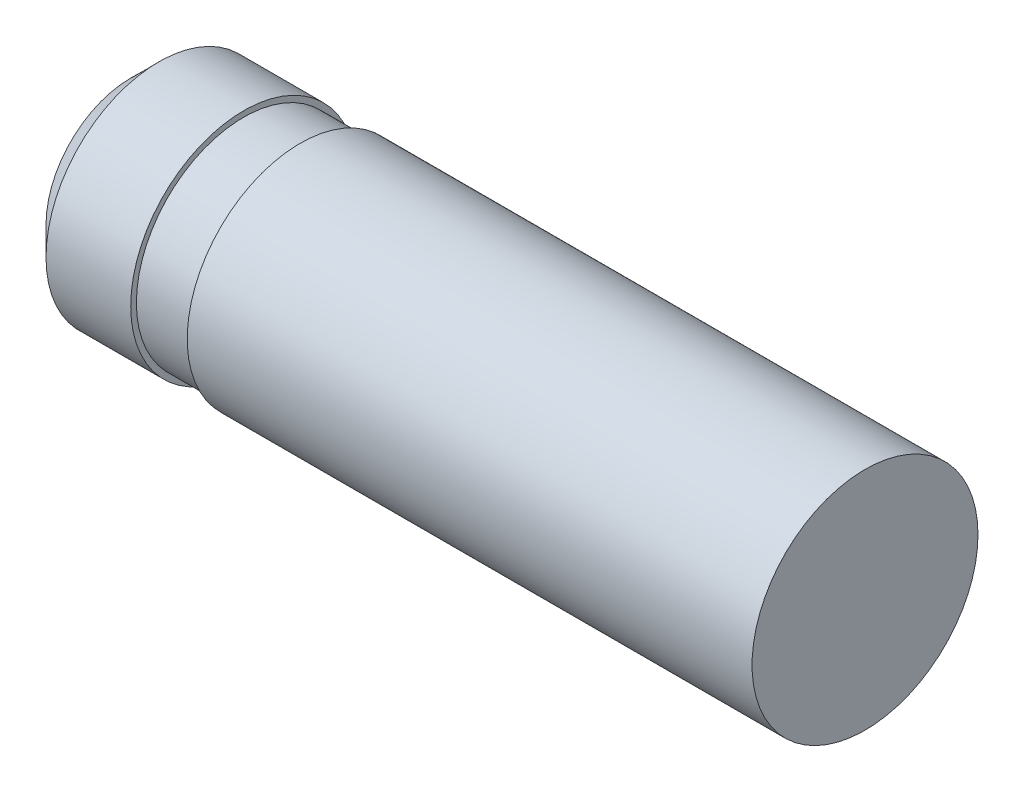
from build123d import *

# Parameters (mm, degrees)
SKETCH1_R           = 2
BOSS_EXTRUDE2_DEPTH = 10
SKETCH3_R           = 1.9
BOSS_EXTRUDE3_DEPTH = 1
SKETCH4_R           = 2
BOSS_EXTRUDE4_DEPTH = 2
CHAMFER2_SIZE       = 0.5


with BuildPart() as part:
    # Sketch1 → Boss-Extrude2 (new body)
    with BuildSketch(Plane(origin=(0, 0, 0), x_dir=(0, 0, -1), z_dir=(1, 0, 0))):
        Circle(SKETCH1_R)
    extrude(amount=-BOSS_EXTRUDE2_DEPTH)

    # Sketch3 → Boss-Extrude3 (add)
    with BuildSketch(Plane.ZY.offset(10)):
        Circle(SKETCH3_R)
    extrude(amount=BOSS_EXTRUDE3_DEPTH)

    # Sketch4 → Boss-Extrude4 (add)
    with BuildSketch(Plane.ZY.offset(11)):
        with Locations(Location((0, 0, 0), (0, 0, 180))):
            Circle(SKETCH4_R)
    extrude(amount=BOSS_EXTRUDE4_DEPTH)

    # Chamfer2
    chamfer2_edges = [part.edges().sort_by_distance(p)[0] for p in [
        (-13, 0, 2),
    ]]
    chamfer(chamfer2_edges, length=CHAMFER2_SIZE)


solid = part.part
